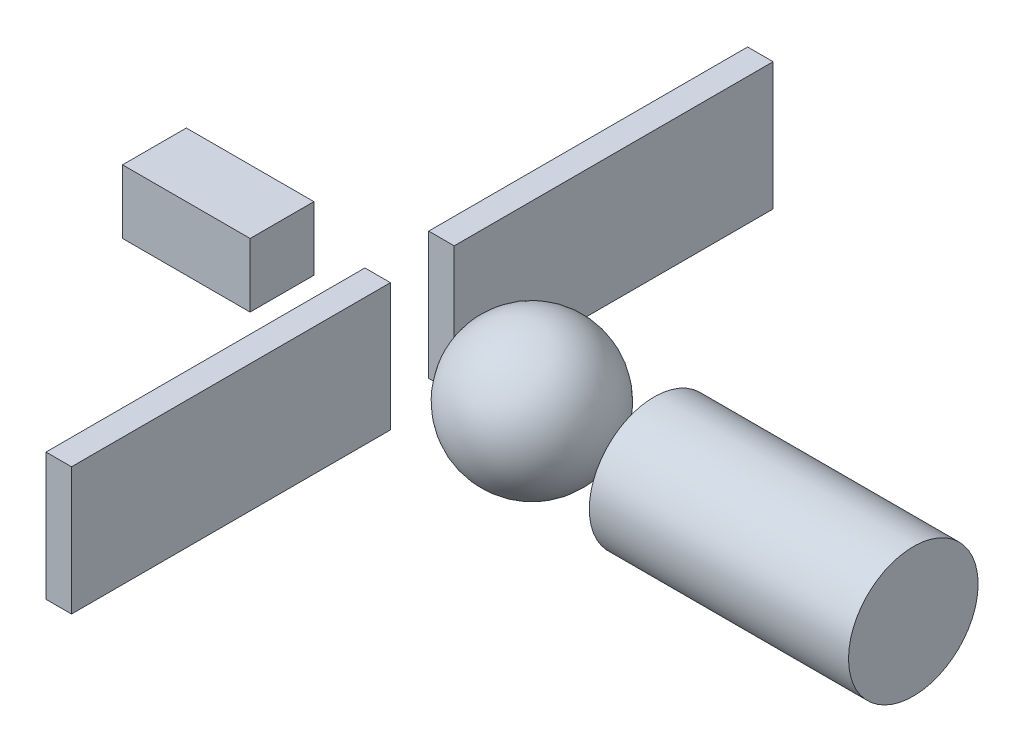
from build123d import *

# Parameters (mm, degrees)
SKETCH2_W             = 100
SKETCH2_H             = 50
BOSS_EXTRUDE2_DEPTH   = 25
SKETCH3_W             = 203.2
SKETCH3_H             = 50.8
SKETCH4_W             = 20
SKETCH4_H             = 250
BOSS_EXTRUDE3_DEPTH   = 50
BOSS_EXTRUDE3_2_DEPTH = 50


with BuildPart() as part:
    # Sketch2 → Boss-Extrude2 (new, symmetric)
    with BuildSketch(Plane.XY):
        with Locations((-150, 0)):
            Rectangle(SKETCH2_W, SKETCH2_H)
    extrude(amount=BOSS_EXTRUDE2_DEPTH, both=True)


with BuildPart() as body_2:
    # Sketch3 → Revolve1 (revolve)
    with BuildSketch(Plane(origin=(0, 0, 0), x_dir=(1, 0, 0), z_dir=(0, 1, 0))):
        with BuildLine():
            Line((40, 0), (151.7, 0))
            ThreePointArc((151.7, 0), (95.85, 55.85), (40, 0))
        make_face()
        with Locations((293.3, 25.4)):
            Rectangle(SKETCH3_W, SKETCH3_H)
    revolve(axis=Axis((0, 0, 0), (1, 0, 0)))


with BuildPart() as body_3:
    # Sketch4 → Boss-Extrude3 (new, symmetric)
    with BuildSketch(Plane(origin=(0, 0, 0), x_dir=(1, 0, 0), z_dir=(0, 1, 0))):
        with Locations((0, 150)):
            Rectangle(SKETCH4_W, SKETCH4_H)
    extrude(amount=BOSS_EXTRUDE3_DEPTH, both=True)


with BuildPart() as body_4:
    # Sketch4 → Boss-Extrude3 2 (new, symmetric)
    with BuildSketch(Plane(origin=(0, 0, 0), x_dir=(1, 0, 0), z_dir=(0, 1, 0))):
        with Locations((0, -150)):
            Rectangle(SKETCH4_W, SKETCH4_H)
    extrude(amount=BOSS_EXTRUDE3_2_DEPTH, both=True)


solid = Compound([part.part, body_2.part, body_3.part, body_4.part])
